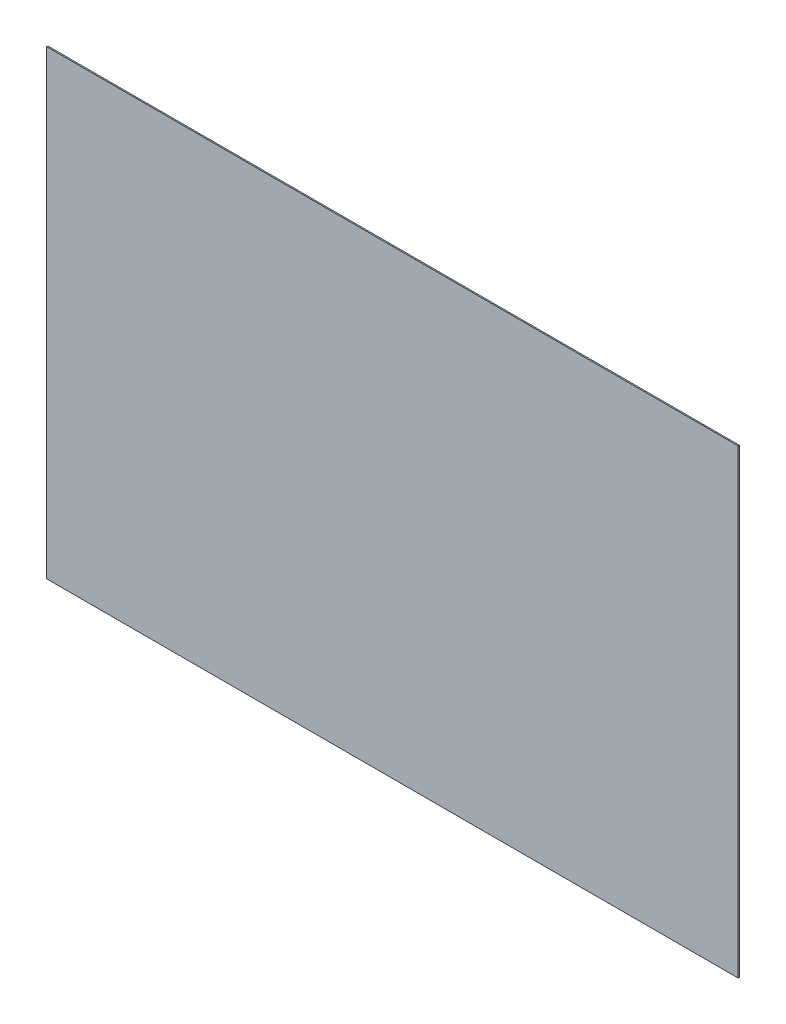
from build123d import *

# Parameters (mm, degrees)
SKETCH3_W           = 914.4
SKETCH3_H           = 609.6
BOSS_EXTRUDE1_DEPTH = 0.79375


with BuildPart() as part:
    # Sketch3 → Boss-Extrude1 (new, symmetric)
    with BuildSketch(Plane.XY):
        Rectangle(SKETCH3_W, SKETCH3_H)
    extrude(amount=BOSS_EXTRUDE1_DEPTH, both=True)


solid = part.part
